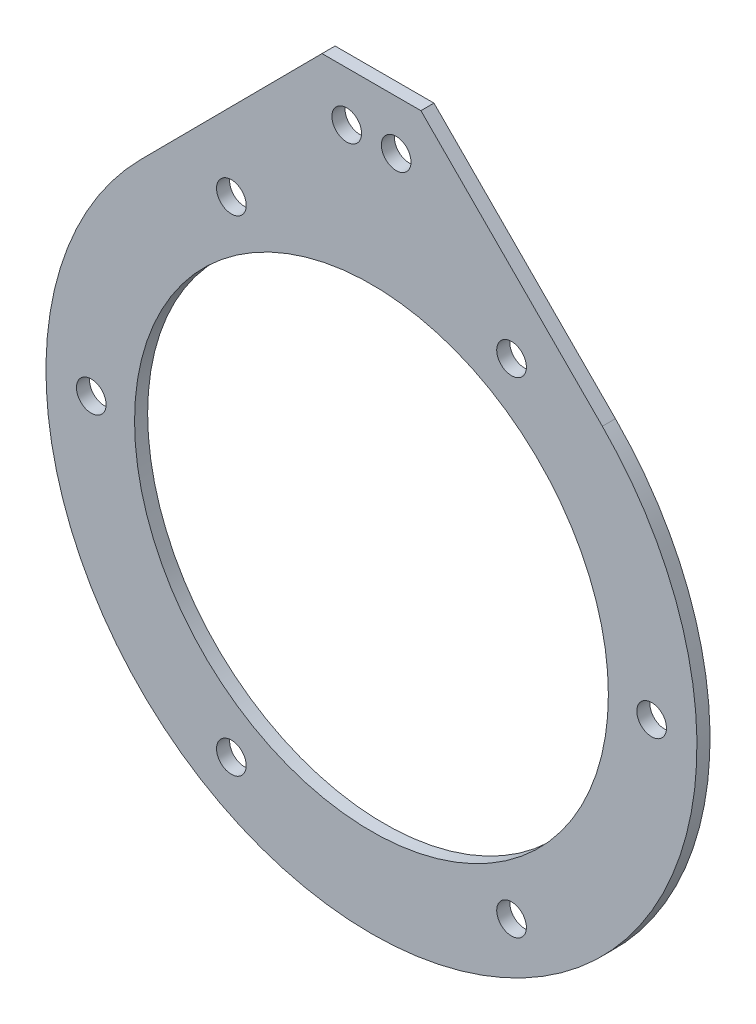
from build123d import *

# Parameters (mm, degrees)
SKETCH1_R                = 39.5
BOSS_EXTRUDE1_DEPTH      = 0.79375
BOSS_EXTRUDE2_DEPTH      = 1.5875
SKETCH2_R                = 28.75
CUT_EXTRUDE1_DEPTH       = 64.739863165
M3_CLEARANCE_HOLE1_D     = 3.6
CIRPATTERN1_COUNT        = 6
M3_CLEARANCE_HOLE2_D     = 3.6
M3_CLEARANCE_HOLE2_DEPTH = 10
M3_CLEARANCE_HOLE2_TIP   = 1.081549114


with BuildPart() as part:
    # Sketch1 → Boss-Extrude1 (new, symmetric)
    with BuildSketch(Plane.XY):
        Circle(SKETCH1_R)
    extrude(amount=BOSS_EXTRUDE1_DEPTH, both=True)

    # Sketch3 → Boss-Extrude2 (add, through all)
    with BuildSketch(Plane.XY.offset(0.79375)):
        Polygon((-28.01836343, 27.842796388), (-6, 50), (6, 50), (28.01836343, 27.842796388), align=None)
    extrude(amount=-BOSS_EXTRUDE2_DEPTH)

    # Sketch2 → Cut-Extrude1 (cut, through all)
    with BuildSketch(Plane.XY.offset(0.79375)):
        Circle(SKETCH2_R)
    extrude(amount=-CUT_EXTRUDE1_DEPTH, mode=Mode.SUBTRACT)

    # M3 Clearance Hole1 (through all)
    with Locations(Plane.XY.offset(0.79375)):
        with Locations((17, -29.444863729)):
            m3_clearance_hole1 = Hole(M3_CLEARANCE_HOLE1_D / 2)

    # CirPattern1: M3 Clearance Hole1 ×6 about axis
    cirpattern1_axis = Axis((0, 0, 0), (0, 0, 1))
    for i in range(1, CIRPATTERN1_COUNT):
        add(m3_clearance_hole1.rotate(cirpattern1_axis, i * 360 / CIRPATTERN1_COUNT), mode=Mode.SUBTRACT)

    # M3 Clearance Hole2
    with Locations(Plane.XY.offset(0.79375)):
        with Locations((3, 44), (-3, 44)):
            Hole(M3_CLEARANCE_HOLE2_D / 2, depth=M3_CLEARANCE_HOLE2_DEPTH)
            with Locations((0, 0, -(M3_CLEARANCE_HOLE2_DEPTH + M3_CLEARANCE_HOLE2_TIP / 2))):  # 118° drill point
                Cone(0, M3_CLEARANCE_HOLE2_D / 2, M3_CLEARANCE_HOLE2_TIP, mode=Mode.SUBTRACT)


solid = part.part
